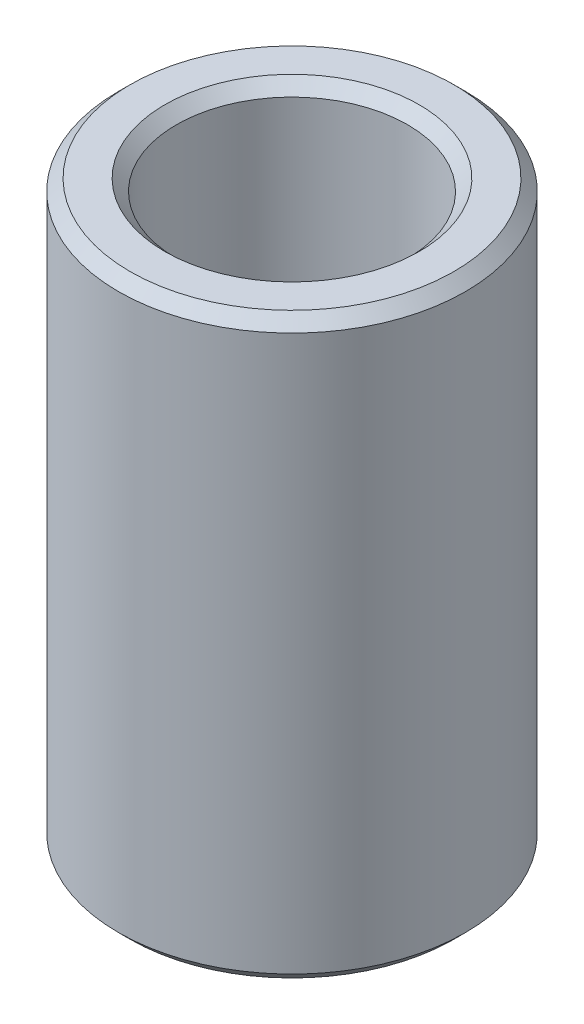
from build123d import *

# Parameters (mm, degrees)
SKETCH1_R           = 3
SKETCH1_R_2         = 2
BOSS_EXTRUDE1_DEPTH = 10
CHAMFER1_SIZE       = 0.2


with BuildPart() as part:
    # Sketch1 → Boss-Extrude1 (new body)
    with BuildSketch(Plane(origin=(0, 0, 0), x_dir=(1, 0, 0), z_dir=(0, 1, 0))):
        with Locations(Location((0, 0, 0), (0, 0, 270))):
            Circle(SKETCH1_R)
        with Locations(Location((0, 0, 0), (0, 0, 270))):
            Circle(SKETCH1_R_2, mode=Mode.SUBTRACT)
    extrude(amount=BOSS_EXTRUDE1_DEPTH)

    # Chamfer1
    chamfer1_edges = [part.edges().sort_by_distance(p)[0] for p in [
        (0, 0, -3),
        (0, 10, -3),
        (0, 10, -2),
    ]]
    chamfer(chamfer1_edges, length=CHAMFER1_SIZE)


solid = part.part
